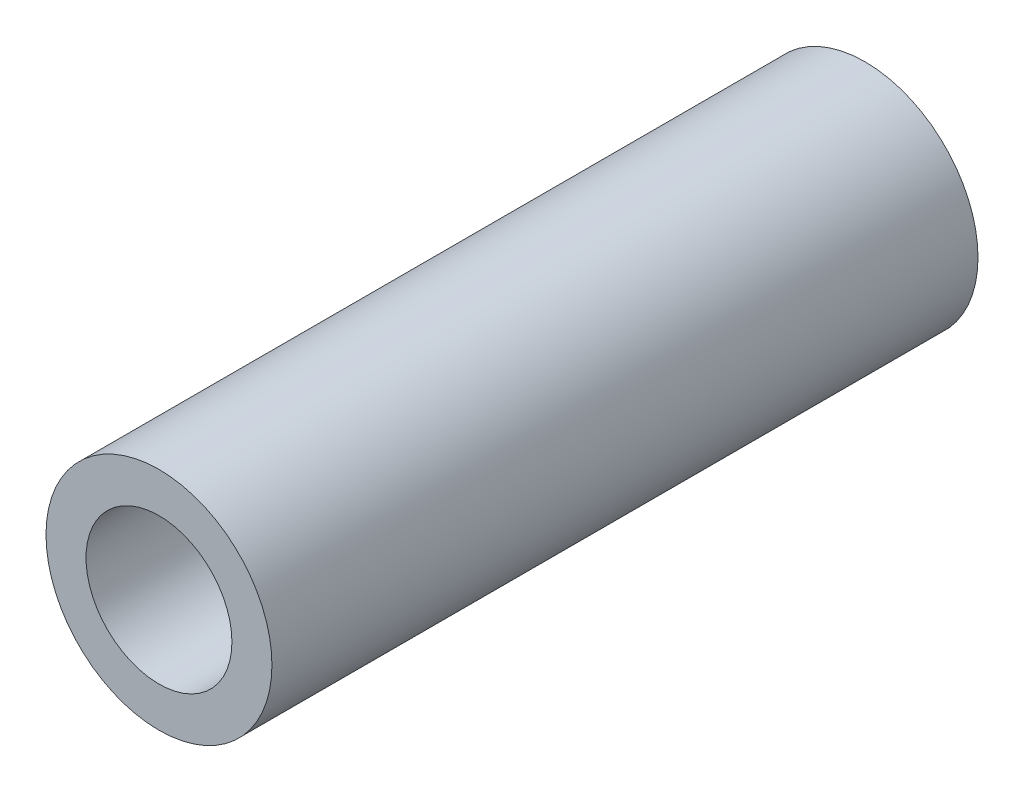
from build123d import *

# Parameters (mm, degrees)
SKETCH1_R           = 2.4
SKETCH1_R_2         = 1.55
BOSS_EXTRUDE1_DEPTH = 15


with BuildPart() as part:
    # Sketch1 → Boss-Extrude1 (new body)
    with BuildSketch(Plane.XY):
        with Locations((-33.892990188, 10.670311674)):
            Circle(SKETCH1_R)
        with Locations((-33.892990188, 10.670311674)):
            Circle(SKETCH1_R_2, mode=Mode.SUBTRACT)
    extrude(amount=BOSS_EXTRUDE1_DEPTH)


solid = part.part
